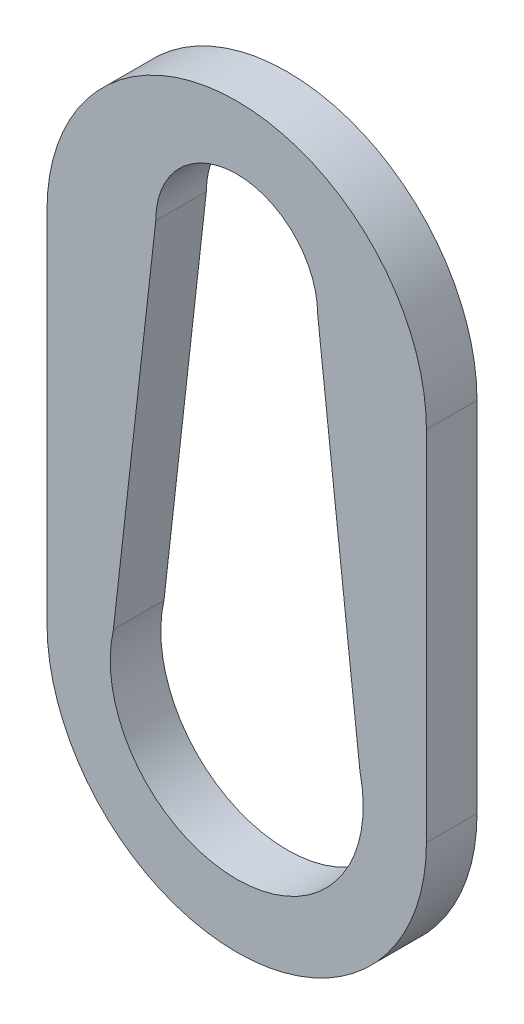
from build123d import *

# Parameters (mm, degrees)
BOSS_EXTRUDE1_DEPTH = 2


with BuildPart() as part:
    # Sketch1 → Boss-Extrude1 (new body)
    with BuildSketch(Plane.XY):
        with BuildLine():
            Line((73.085447554, 74.077647485), (73.085447554, 59.931475915))
            ThreePointArc((73.085447554, 59.931475915), (80.585447554, 52.431475915), (88.085447554, 59.931475915))
            Line((88.085447554, 59.931475915), (88.085447554, 74.077647485))
            ThreePointArc((88.085447554, 74.077647485), (80.585447554, 81.577647485), (73.085447554, 74.077647485))
        make_face()
        with BuildLine():
            Line((75.711262835, 61.046071504), (77.385447554, 75.877647485))
            ThreePointArc((77.385447554, 75.877647485), (80.585447554, 79.077647485), (83.785447554, 75.877647485))
            Line((83.785447554, 75.877647485), (85.459632273, 61.046071504))
            ThreePointArc((85.459632273, 61.046071504), (85.553894172, 60.492312971), (85.585447554, 59.931475915))
            ThreePointArc((85.585447554, 59.931475915), (80.585447554, 54.931475915), (75.585447554, 59.931475915))
            ThreePointArc((75.585447554, 59.931475915), (75.617000936, 60.492312971), (75.711262835, 61.046071504))
        make_face(mode=Mode.SUBTRACT)
    extrude(amount=BOSS_EXTRUDE1_DEPTH)


solid = part.part
